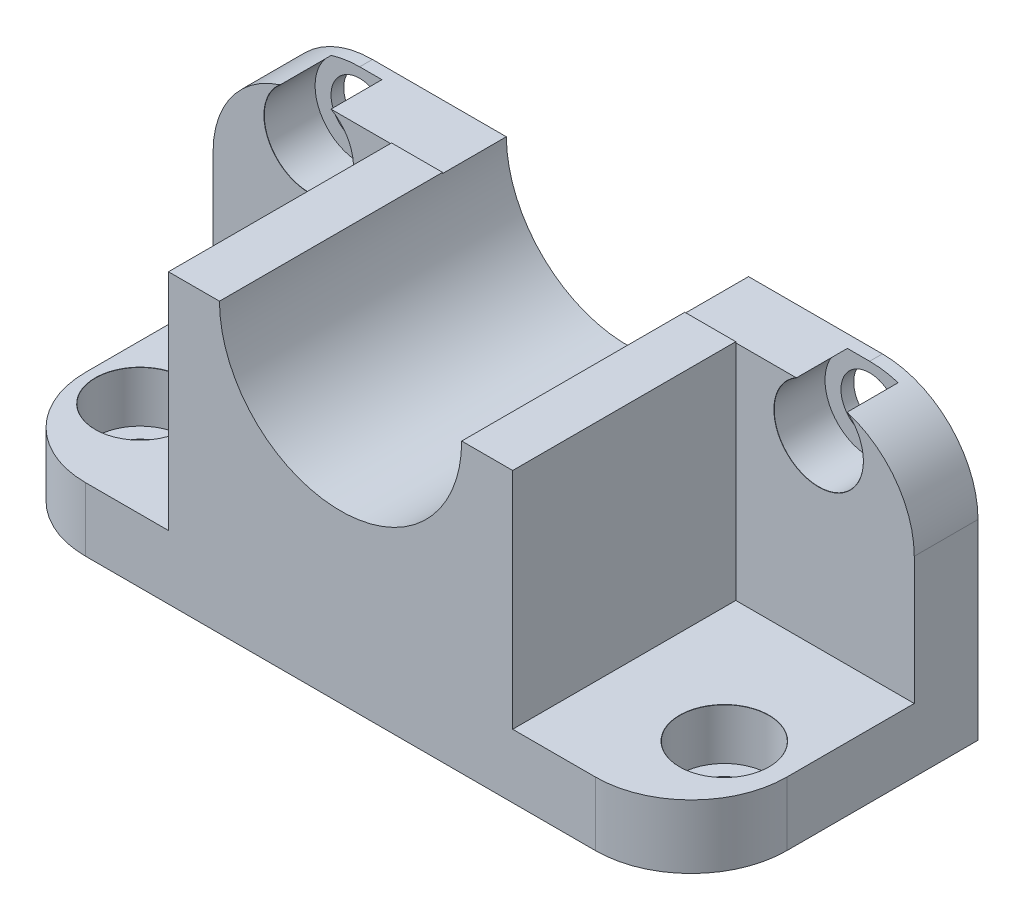
from build123d import *

# Parameters (mm, degrees)
EXTRUDE_1_DEPTH          = 35
SKETCH_2_W               = 110
SKETCH_2_H               = 45
EXTRUDE_2_DEPTH          = 10
CUT_EXTRUDE_1_DEPTH      = 85.198125322
CUT_EXTRUDE_1_DEPTH_BACK = 85.198125322
CUT_EXTRUDE_2_DEPTH      = 50
FILLET_2_R               = 15


with BuildPart() as part:
    # 스케치1 → 보스-돌출1 (new body)
    with BuildSketch(Plane.XY):
        Polygon((-55, 0), (55, 0), (55, 10), (27, 10), (27, 45.158878505), (-27, 45.158878505), (-27, 10), (-55, 10), align=None)
    extrude(amount=EXTRUDE_1_DEPTH)

    # 스케치2 → 보스-돌출2 (add)
    with BuildSketch(Plane(origin=(0, 0, 0), x_dir=(-1, 0, 0), z_dir=(0, 0, -1))):
        with Locations((0, 22.5)):
            Rectangle(SKETCH_2_W, SKETCH_2_H)
    extrude(amount=EXTRUDE_2_DEPTH)

    # 스케치3 → 컷-돌출1 (cut, two sides: drawn at the far end of the back side and taken through both)
    with BuildSketch(Plane.XY.offset(35).offset(-CUT_EXTRUDE_1_DEPTH_BACK)):
        with BuildLine():
            ThreePointArc((-16, 45.158878505), (0, 29.158878505), (16, 45.158878505))
            Line((16, 45.158878505), (-16, 45.158878505))
        make_face()
    extrude(amount=CUT_EXTRUDE_1_DEPTH + CUT_EXTRUDE_1_DEPTH_BACK, mode=Mode.SUBTRACT)

    # 스케치4 → 컷-돌출2 (cut)
    with BuildSketch(Plane(origin=(0, 0, -10), x_dir=(-1, 0, 0), z_dir=(0, 0, -1))):
        with BuildLine():
            Line((-19, 45.158878505), (19, 45.158878505))
            ThreePointArc((19, 45.158878505), (0, 26.158878505), (-19, 45.158878505))
        make_face()
    extrude(amount=-CUT_EXTRUDE_2_DEPTH, mode=Mode.SUBTRACT)

    # 스케치12 → M8 소켓 머리 캡 나사용 카운터보어5 (revolve, cut)
    with BuildSketch(Plane(origin=(-40, 38.932438824, 0), x_dir=(0, -1, 0), z_dir=(1, 0, 0))):
        Polygon((0, 0), (0, 10), (4.5, 10), (4.5, 8), (7, 8), (7, 0.024142219), (7.025, 0), align=None)
    revolve(axis=Axis((-40, 38.932438824, 6.35), (0, 0, -1)), mode=Mode.SUBTRACT)

    # 스케치13 → M8 소켓 머리 캡 나사용 카운터보어4 (revolve, cut)
    with BuildSketch(Plane(origin=(-46.472033472, 10, 20), x_dir=(0, 0, 1), z_dir=(1, 0, 0))):
        Polygon((0, 0), (0, 10), (4.5, 10), (4.5, 8), (7, 8), (7, 0.024142219), (7.025, 0), align=None)
    revolve(axis=Axis((-46.472033472, 16.35, 20), (0, -1, 0)), mode=Mode.SUBTRACT)

    # 스케치15 → M8 소켓 머리 캡 나사용 카운터보어3 (revolve, cut)
    with BuildSketch(Plane(origin=(45.201027452, 10, 20), x_dir=(0, 0, 1), z_dir=(1, 0, 0))):
        Polygon((0, 0), (0, 10), (4.5, 10), (4.5, 8), (7, 8), (7, 0.024142219), (7.025, 0), align=None)
    revolve(axis=Axis((45.201027452, 16.35, 20), (0, -1, 0)), mode=Mode.SUBTRACT)

    # 스케치16 → M8 소켓 머리 캡 나사용 카운터보어6 (revolve, cut)
    with BuildSketch(Plane(origin=(40, 38.932438824, 0), x_dir=(0, -1, 0), z_dir=(1, 0, 0))):
        Polygon((0, 0), (0, 10), (4.5, 10), (4.5, 8), (7, 8), (7, 0.024142219), (7.025, 0), align=None)
    revolve(axis=Axis((40, 38.932438824, 6.35), (0, 0, -1)), mode=Mode.SUBTRACT)

    # 필렛2
    fillet_2_edges = [part.edges().sort_by_distance(p)[0] for p in [
        (-55, 45, -5),
        (55, 45, -5),
        (55, 5, 35),
        (-55, 5, 35),
    ]]
    fillet(fillet_2_edges, radius=FILLET_2_R)


solid = part.part
